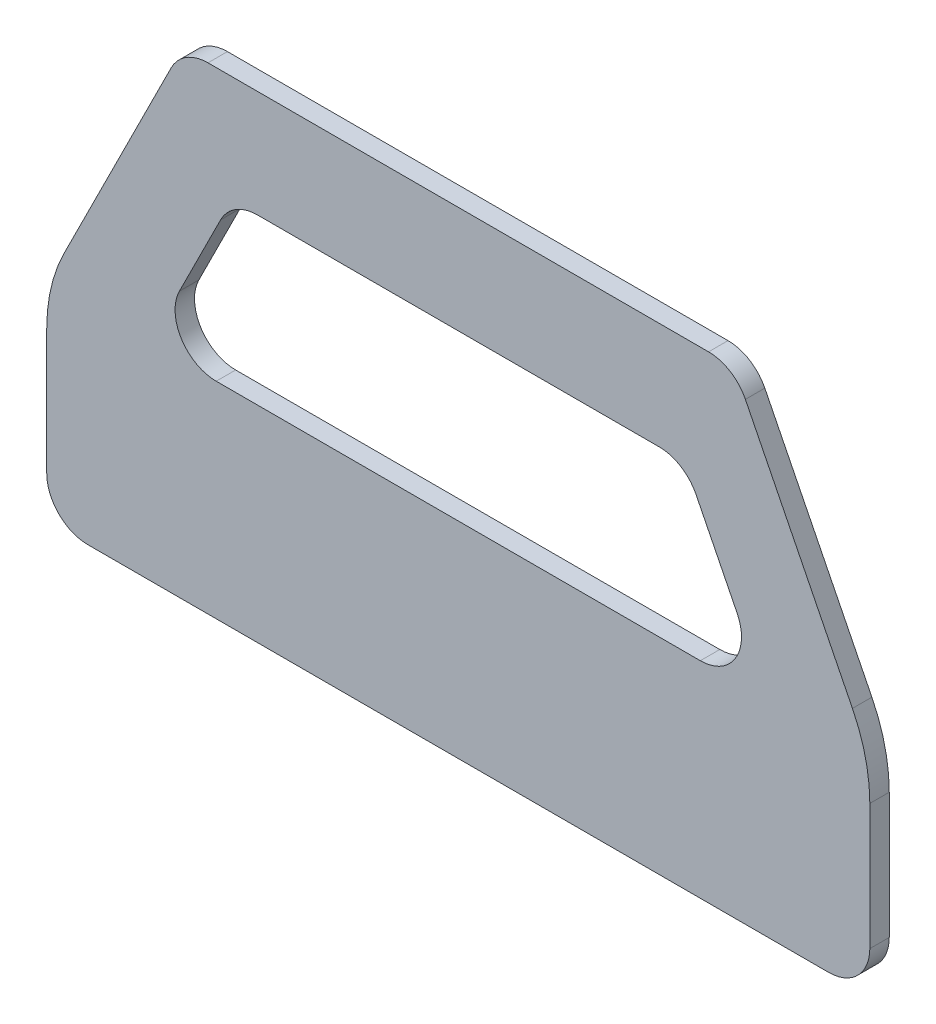
from build123d import *

# Parameters (mm, degrees)
BOSS_EXTRUDE1_DEPTH = 6


with BuildPart() as part:
    # Sketch1 → Boss-Extrude1 (new body)
    with BuildSketch(Plane.XY):
        with BuildLine():
            Line((12.7, 0), (241.3, 0))
            ThreePointArc((241.3, 0), (250.280256121, 3.719743879), (254, 12.7))
            Line((254, 12.7), (254, 51.507746743))
            ThreePointArc((254, 51.507746743), (252.641048665, 63.179195107), (248.636901303, 74.226197394))
            Line((248.636901303, 74.226197394), (215.600193669, 140.299612663))
            ThreePointArc((215.600193669, 140.299612663), (210.917753467, 145.423265266), (204.240968343, 147.32))
            Line((204.240968343, 147.32), (49.759031657, 147.32))
            ThreePointArc((49.759031657, 147.32), (43.082246533, 145.423265266), (38.399806331, 140.299612663))
            Line((38.399806331, 140.299612663), (5.363098697, 74.226197394))
            ThreePointArc((5.363098697, 74.226197394), (1.358951335, 63.179195107), (0, 51.507746743))
            Line((0, 51.507746743), (0, 12.7))
            ThreePointArc((0, 12.7), (3.719743879, 3.719743879), (12.7, 0))
        make_face()
        with BuildLine():
            Line((40.939806331, 81.879612663), (53.639806331, 107.279612663))
            ThreePointArc((53.639806331, 107.279612663), (58.322246533, 112.403265266), (64.999031657, 114.3))
            Line((64.999031657, 114.3), (189.000968343, 114.3))
            ThreePointArc((189.000968343, 114.3), (195.677753467, 112.403265266), (200.360193669, 107.279612663))
            Line((200.360193669, 107.279612663), (213.060193669, 81.879612663))
            ThreePointArc((213.060193669, 81.879612663), (212.504233609, 69.523214876), (201.700968343, 63.5))
            Line((201.700968343, 63.5), (52.299031657, 63.5))
            ThreePointArc((52.299031657, 63.5), (41.495766391, 69.523214876), (40.939806331, 81.879612663))
        make_face(mode=Mode.SUBTRACT)
    extrude(amount=BOSS_EXTRUDE1_DEPTH)


solid = part.part
